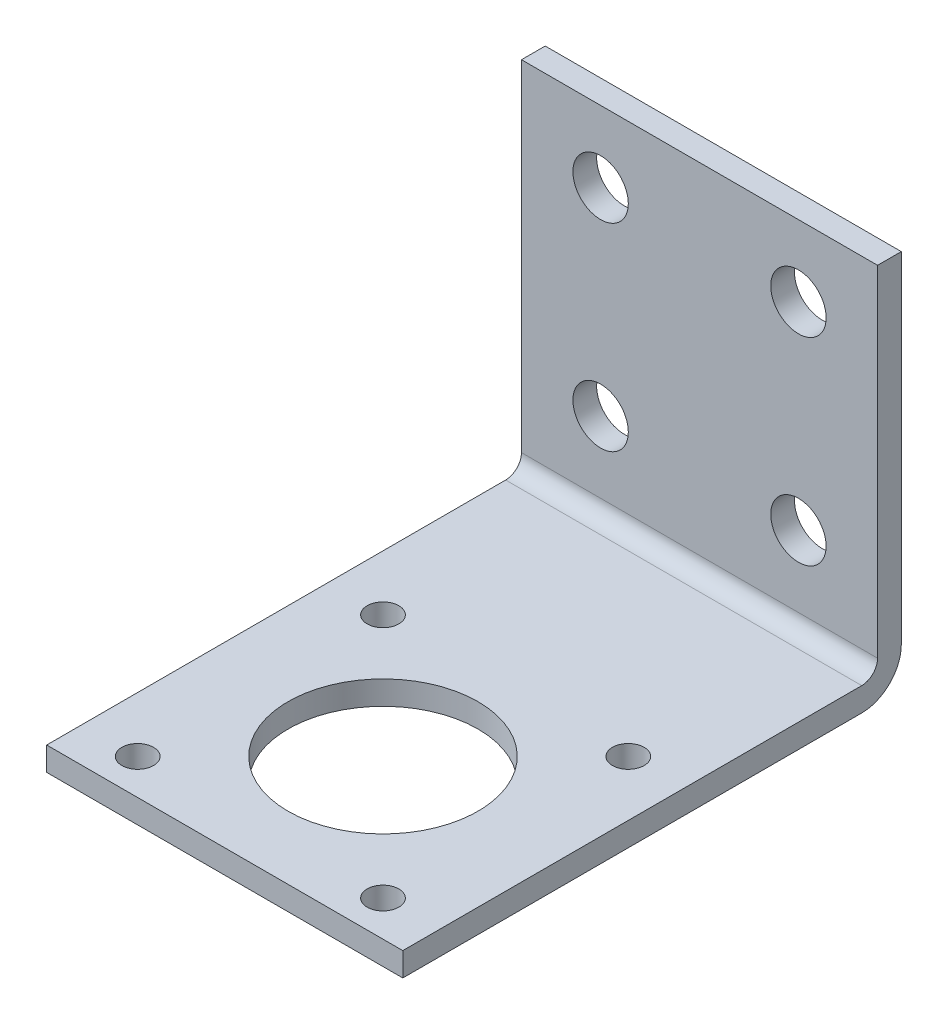
from build123d import *

# Parameters (mm, degrees)
BOSS_EXTRUDE1_DEPTH = 45
FILLET1_R           = 2
FILLET2_R           = 5
CUT_EXTRUDE1_REACH  = 93.093
SKETCH2_R           = 2
SKETCH2_R_2         = 12
SKETCH3_R           = 3.5
CUT_EXTRUDE2_DEPTH  = 90.044932478


with BuildPart() as part:
    # Sketch1 → Boss-Extrude1 (new body)
    with BuildSketch(Plane(origin=(0, 0, 0), x_dir=(0, 0, -1), z_dir=(1, 0, 0))):
        Polygon((0, 0), (0, 48), (-3, 48), (-3, 3), (-63, 3), (-63, 0), align=None)
    extrude(amount=BOSS_EXTRUDE1_DEPTH)

    # Fillet1
    fillet1_edges = [part.edges().sort_by_distance(p)[0] for p in [
        (22.5, 3, 3),
    ]]
    fillet(fillet1_edges, radius=FILLET1_R)

    # Fillet2
    fillet2_edges = [part.edges().sort_by_distance(p)[0] for p in [
        (22.5, 0, 0),
    ]]
    fillet(fillet2_edges, radius=FILLET2_R)

    # Sketch2 → Cut-Extrude1 (cut, up to next)
    with BuildSketch(Plane.XZ, mode=Mode.PRIVATE) as cut_extrude1_sk1:
        with Locations(Location((38, 58.5, 0), (0, 0, 270))):
            Circle(SKETCH2_R)
    cut_extrude1_tool1 = extrude(cut_extrude1_sk1.sketch, amount=-CUT_EXTRUDE1_REACH, mode=Mode.PRIVATE) & part.part
    # Sketch2 → Cut-Extrude1 (cut, up to next)
    with BuildSketch(Plane.XZ, mode=Mode.PRIVATE) as cut_extrude1_sk2:
        with Locations(Location((38, 27.5, 0), (0, 0, 270))):
            Circle(SKETCH2_R)
    cut_extrude1_tool2 = extrude(cut_extrude1_sk2.sketch, amount=-CUT_EXTRUDE1_REACH, mode=Mode.PRIVATE) & part.part
    # Sketch2 → Cut-Extrude1 (cut, up to next)
    with BuildSketch(Plane.XZ, mode=Mode.PRIVATE) as cut_extrude1_sk3:
        with Locations(Location((7, 58.5, 0), (0, 0, 270))):
            Circle(SKETCH2_R)
    cut_extrude1_tool3 = extrude(cut_extrude1_sk3.sketch, amount=-CUT_EXTRUDE1_REACH, mode=Mode.PRIVATE) & part.part
    # Sketch2 → Cut-Extrude1 (cut, up to next)
    with BuildSketch(Plane.XZ, mode=Mode.PRIVATE) as cut_extrude1_sk4:
        with Locations(Location((7, 27.5, 0), (0, 0, 270))):
            Circle(SKETCH2_R)
    cut_extrude1_tool4 = extrude(cut_extrude1_sk4.sketch, amount=-CUT_EXTRUDE1_REACH, mode=Mode.PRIVATE) & part.part
    # Sketch2 → Cut-Extrude1 (cut, up to next)
    with BuildSketch(Plane.XZ, mode=Mode.PRIVATE) as cut_extrude1_sk5:
        with Locations(Location((22.5, 43, 0), (0, 0, 270))):
            Circle(SKETCH2_R_2)
    cut_extrude1_tool5 = extrude(cut_extrude1_sk5.sketch, amount=-CUT_EXTRUDE1_REACH, mode=Mode.PRIVATE) & part.part
    add(cut_extrude1_tool1.solids().sort_by_distance((38, 0, 58.5))[0], mode=Mode.SUBTRACT)
    add(cut_extrude1_tool2.solids().sort_by_distance((38, 0, 27.5))[0], mode=Mode.SUBTRACT)
    add(cut_extrude1_tool3.solids().sort_by_distance((7, 0, 58.5))[0], mode=Mode.SUBTRACT)
    add(cut_extrude1_tool4.solids().sort_by_distance((7, 0, 27.5))[0], mode=Mode.SUBTRACT)
    add(cut_extrude1_tool5.solids().sort_by_distance((22.5, 0, 43))[0], mode=Mode.SUBTRACT)

    # Sketch3 → Cut-Extrude2 (cut, through all)
    with BuildSketch(Plane.XY.offset(3)):
        with Locations((35, 39)):
            Circle(SKETCH3_R)
        with Locations((35, 14)):
            Circle(SKETCH3_R)
        with Locations((10, 39)):
            Circle(SKETCH3_R)
        with Locations((10, 14)):
            Circle(SKETCH3_R)
    extrude(amount=-CUT_EXTRUDE2_DEPTH, mode=Mode.SUBTRACT)


solid = part.part
